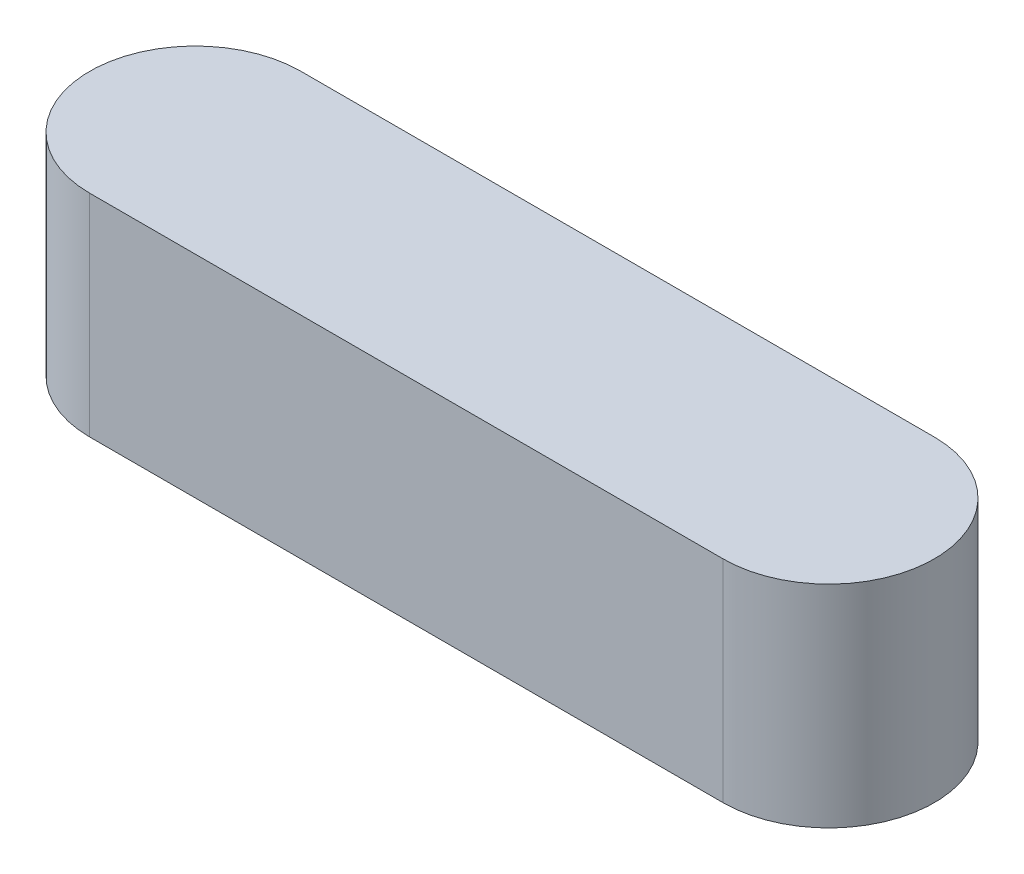
from build123d import *

# Parameters (mm, degrees)
EXTRUDE_1_DEPTH = 3


with BuildPart() as part:
    # 草图1 → 凸台-拉伸1 (new body)
    with BuildSketch(Plane(origin=(0, 0, 0), x_dir=(1, 0, 0), z_dir=(0, 1, 0))):
        with BuildLine():
            Line((0, 1.5), (9, 1.5))
            ThreePointArc((9, 1.5), (10.5, 0), (9, -1.5))
            Line((9, -1.5), (0, -1.5))
            ThreePointArc((0, -1.5), (-1.5, 0), (0, 1.5))
        make_face()
    extrude(amount=EXTRUDE_1_DEPTH)


solid = part.part
